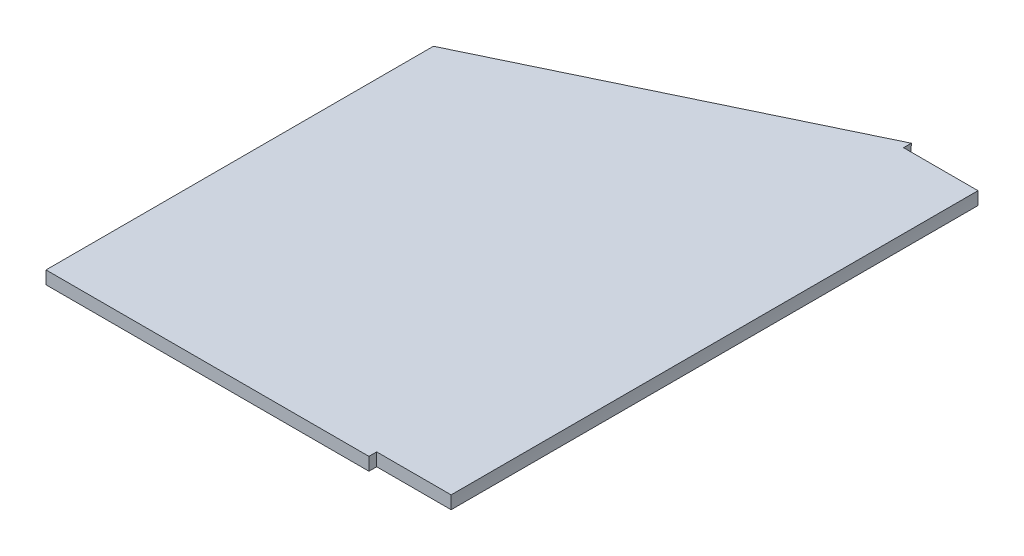
from build123d import *

# Parameters (mm, degrees)
BOSS_EXTRUDE1_DEPTH      = 2.5
BOSS_EXTRUDE1_DEPTH_BACK = 2.5
SKETCH2_R                = 51.95
CUT_EXTRUDE1_DEPTH       = 245.399774959
SKETCH3_R                = 80.75
CUT_EXTRUDE2_DEPTH       = 3
CUT_EXTRUDE3_START       = -3
SKETCH4_R                = 80.75
CUT_EXTRUDE3_DEPTH       = 3


with BuildPart() as part:
    # Sketch1 → Boss-Extrude1 (new, two sides: drawn at the far end of the back side and taken through both)
    with BuildSketch(Plane(origin=(0, 0, 0), x_dir=(1, 0, 0), z_dir=(0, 1, 0)).offset(-BOSS_EXTRUDE1_DEPTH_BACK)):
        Polygon((-125, 150), (-125, 0), (0, 0), (80.75, 0), (80.75, 210), (0, 210), align=None)
    extrude(amount=BOSS_EXTRUDE1_DEPTH + BOSS_EXTRUDE1_DEPTH_BACK)

    # Sketch2 → Cut-Extrude1 (cut, through all)
    with BuildSketch(Plane(origin=(0, 0, -210), x_dir=(-1, 0, 0), z_dir=(0, 0, -1))):
        with Locations((-80.75, 0)):
            Circle(SKETCH2_R)
    extrude(amount=-CUT_EXTRUDE1_DEPTH, mode=Mode.SUBTRACT)

    # Sketch3 → Cut-Extrude2 (cut)
    with BuildSketch(Plane(origin=(0, 0, -210), x_dir=(-1, 0, 0), z_dir=(0, 0, -1))):
        with Locations((-80.75, 0)):
            Circle(SKETCH3_R)
    extrude(amount=-CUT_EXTRUDE2_DEPTH, mode=Mode.SUBTRACT)

    # Sketch4 → Cut-Extrude3 (cut)
    with BuildSketch(Plane.XY.offset(CUT_EXTRUDE3_START)):
        with Locations((80.75, 0)):
            Circle(SKETCH4_R)
    extrude(amount=CUT_EXTRUDE3_DEPTH, mode=Mode.SUBTRACT)


solid = part.part
